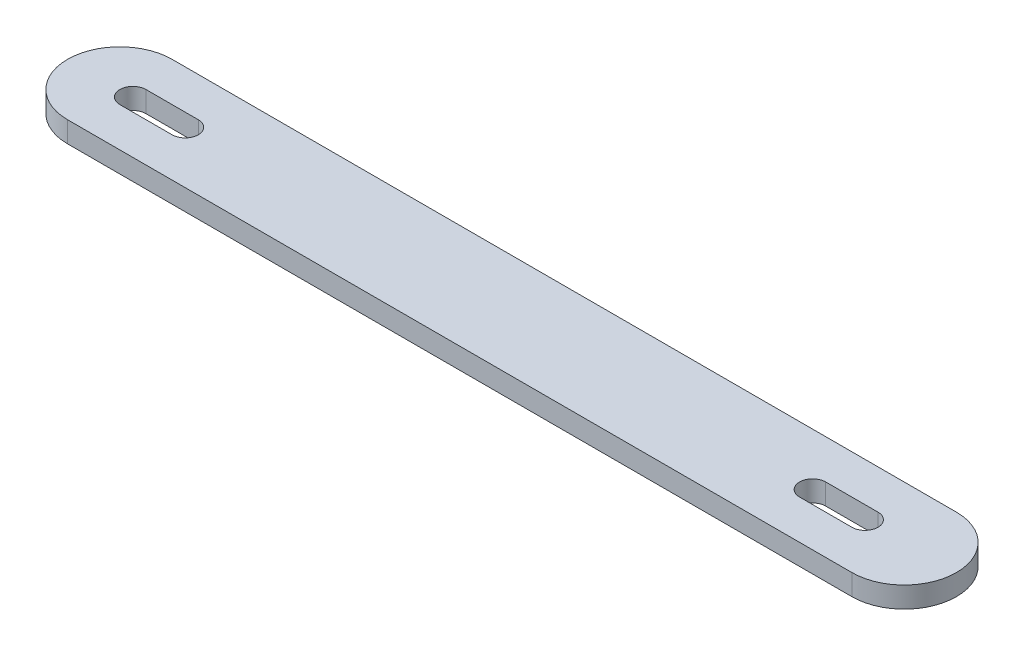
from build123d import *

# Parameters (mm, degrees)
BOSS_EXTRUDE1_DEPTH = 4


with BuildPart() as part:
    # Sketch1 → Boss-Extrude1 (new body)
    with BuildSketch(Plane(origin=(0, 0, 0), x_dir=(1, 0, 0), z_dir=(0, 1, 0))):
        with BuildLine():
            Line((-75, 10), (75, 10))
            ThreePointArc((75, 10), (85, 0), (75, -10))
            Line((75, -10), (-75, -10))
            ThreePointArc((-75, -10), (-85, 0), (-75, 10))
        make_face()
        with BuildLine():
            Line((-72.5, 2.5), (-62.5, 2.5))
            ThreePointArc((-62.5, 2.5), (-60, 0), (-62.5, -2.5))
            Line((-62.5, -2.5), (-72.5, -2.5))
            ThreePointArc((-72.5, -2.5), (-75, 0), (-72.5, 2.5))
        make_face(mode=Mode.SUBTRACT)
        with BuildLine():
            Line((67.5, -2.5), (57.5, -2.5))
            ThreePointArc((57.5, -2.5), (55, 0), (57.5, 2.5))
            Line((57.5, 2.5), (67.5, 2.5))
            ThreePointArc((67.5, 2.5), (70, 0), (67.5, -2.5))
        make_face(mode=Mode.SUBTRACT)
    extrude(amount=BOSS_EXTRUDE1_DEPTH)


solid = part.part
